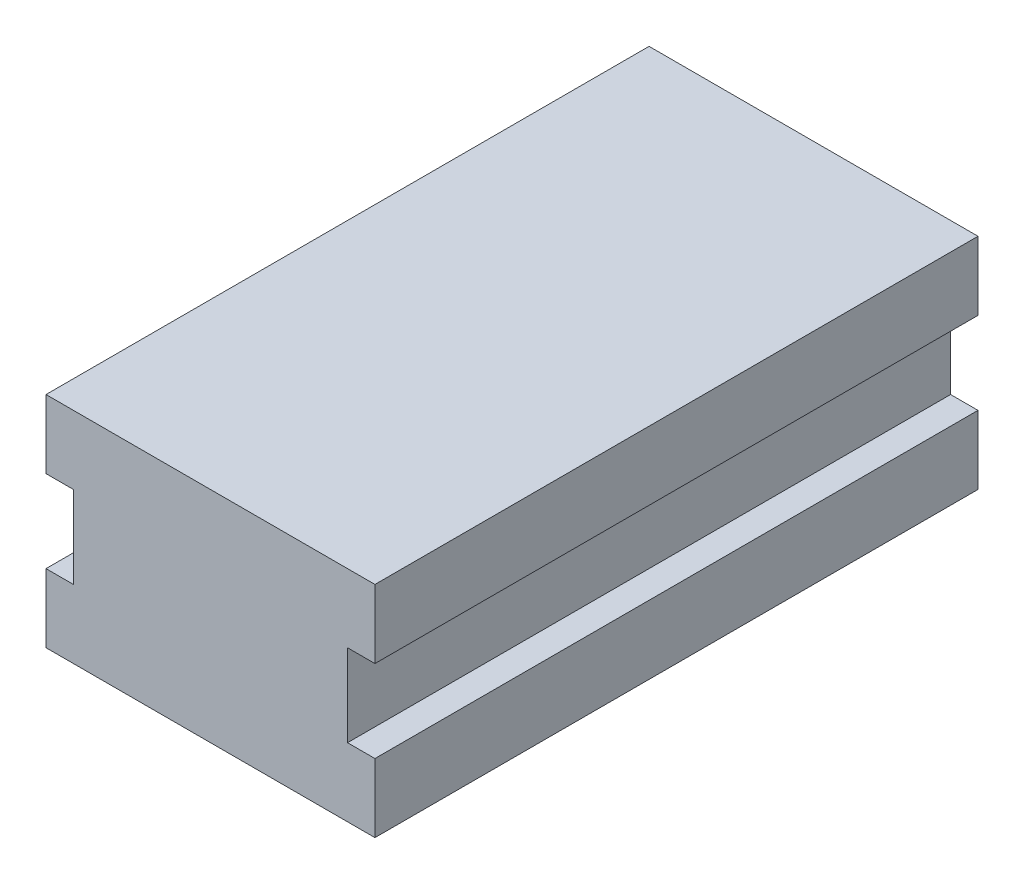
from build123d import *

# Parameters (mm, degrees)
BOSS_EXTRUDE1_DEPTH = 22


with BuildPart() as part:
    # Sketch1 → Boss-Extrude1 (new body)
    with BuildSketch(Plane.XY):
        Polygon((12, 8), (12, 5.5), (11, 5.5), (11, 2.5), (12, 2.5), (12, 0), (0, 0), (0, 2.5), (1, 2.5), (1, 5.5), (0, 5.5), (0, 8), align=None)
    extrude(amount=BOSS_EXTRUDE1_DEPTH)


solid = part.part
